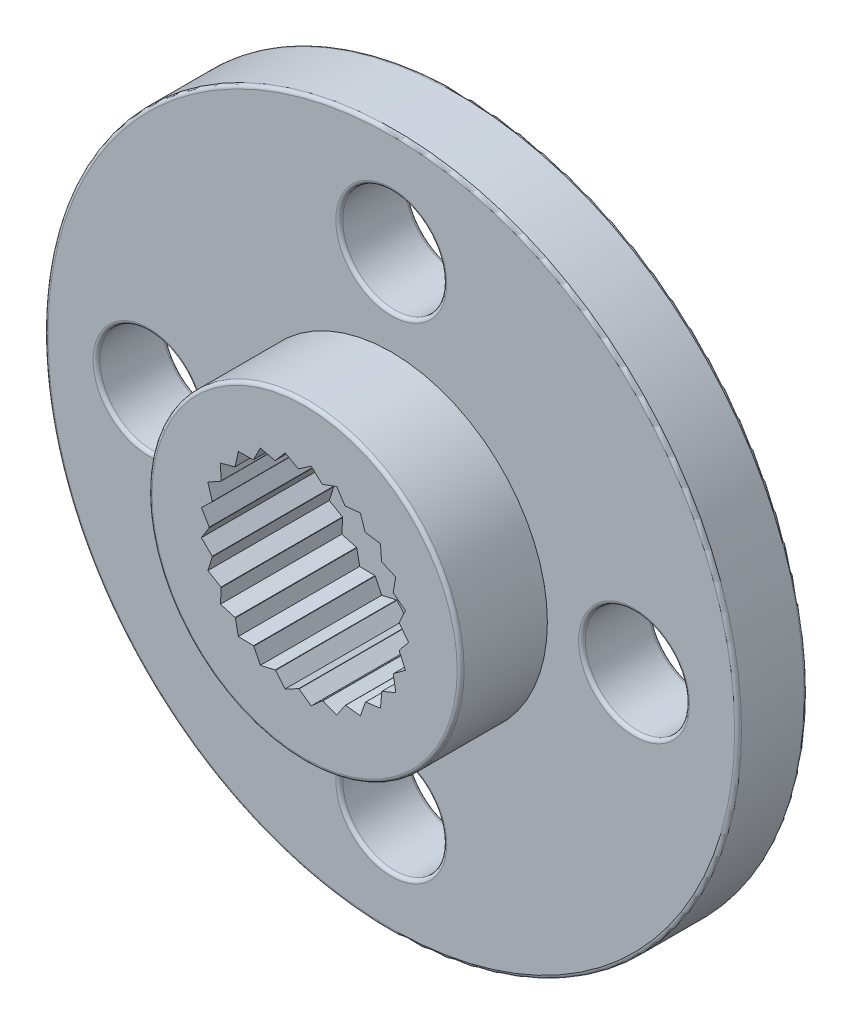
from build123d import *

# Parameters (mm, degrees)
SKETCH1_R           = 10
BOSS_EXTRUDE1_DEPTH = 2
SKETCH2_R           = 4.5
BOSS_EXTRUDE2_DEPTH = 2.5
SKETCH3_R           = 2.75
CUT_EXTRUDE1_DEPTH  = 3.5
SKETCH4_R           = 1.5
CUT_EXTRUDE2_DEPTH  = 15.568802284
CUT_EXTRUDE3_DEPTH  = 3.5
CIRPATTERN1_COUNT   = 25
SKETCH6_R           = 1.5
CUT_EXTRUDE4_DEPTH  = 15.361406616
FILLET1_R           = 0.1
FILLET2_R           = 0.1


with BuildPart() as part:
    # Sketch1 → Boss-Extrude1 (new body)
    with BuildSketch(Plane.XY):
        Circle(SKETCH1_R)
    extrude(amount=BOSS_EXTRUDE1_DEPTH)

    # Sketch2 → Boss-Extrude2 (add)
    with BuildSketch(Plane.XY.offset(2)):
        Circle(SKETCH2_R)
    extrude(amount=BOSS_EXTRUDE2_DEPTH)

    # Sketch3 → Cut-Extrude1 (cut)
    with BuildSketch(Plane.XY.offset(4.5)):
        Circle(SKETCH3_R)
    extrude(amount=-CUT_EXTRUDE1_DEPTH, mode=Mode.SUBTRACT)

    # Sketch4 → Cut-Extrude2 (cut, through all)
    with BuildSketch(Plane.XY.offset(1)):
        Circle(SKETCH4_R)
    extrude(amount=-CUT_EXTRUDE2_DEPTH, mode=Mode.SUBTRACT)

    # Sketch5 → Cut-Extrude3 (cut)
    with BuildSketch(Plane.XY.offset(4.5)):
        Polygon((-2.656507983, 0.682075321), (-2.682344512, 0.606240809), (-2.75, 0), (-2.976344104, 0.375999701), align=None)
    cut_extrude3 = extrude(amount=-CUT_EXTRUDE3_DEPTH, mode=Mode.SUBTRACT)

    # CirPattern1: Cut-Extrude3 ×25 about axis
    cirpattern1_axis = Axis((0, 0, 0), (0, 0, 1))
    for i in range(1, CIRPATTERN1_COUNT):
        add(cut_extrude3.rotate(cirpattern1_axis, i * 360 / CIRPATTERN1_COUNT), mode=Mode.SUBTRACT)

    # Sketch6 → Cut-Extrude4 (cut, through all)
    with BuildSketch(Plane.XY.offset(2)):
        with Locations((-7, 0)):
            Circle(SKETCH6_R)
        with Locations(Location((7, 0, 0), (0, 0, 180))):
            Circle(SKETCH6_R)
        with Locations(Location((0, 7, 0), (0, 0, 180))):
            Circle(SKETCH6_R)
        with Locations((0, -7)):
            Circle(SKETCH6_R)
    extrude(amount=-CUT_EXTRUDE4_DEPTH, mode=Mode.SUBTRACT)

    # Fillet1
    fillet1_edges = [part.edges().sort_by_distance(p)[0] for p in [
        (8.5, 0, 2),
    ]]
    fillet(fillet1_edges, radius=FILLET1_R)

    # Fillet2
    fillet2_edges = [part.edges().sort_by_distance(p)[0] for p in [
        (-1.5, 0, 0),
        (-1.5, 0, 1),
        (-10, 0, 0),
        (-8.5, 0, 0),
        (-8.5, 0, 2),
        (-10, 0, 2),
        (8.5, 0, 0),
        (1.5, 7, 0),
        (1.5, 7, 2),
        (-1.5, -7, 0),
        (-1.5, -7, 2),
        (-4.5, 0, 4.5),
    ]]
    fillet(fillet2_edges, radius=FILLET2_R)


solid = part.part
